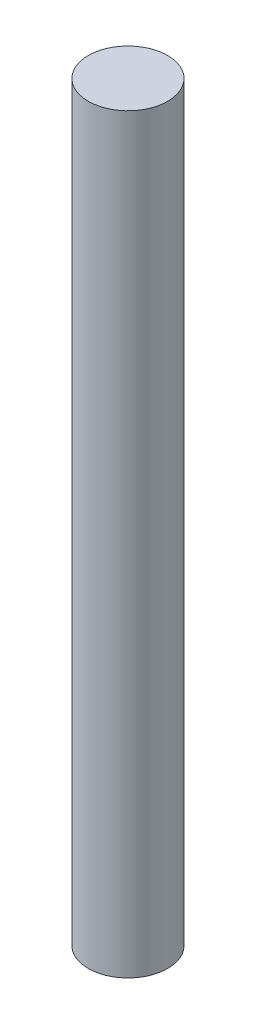
from build123d import *

# Parameters (mm, degrees)
SKETCH1_R           = 1.585
BOSS_EXTRUDE1_DEPTH = 30


with BuildPart() as part:
    # Sketch1 → Boss-Extrude1 (new body)
    with BuildSketch(Plane(origin=(0, 0, 0), x_dir=(1, 0, 0), z_dir=(0, 1, 0))):
        with Locations(Location((0, 0, 0), (0, 0, 270))):
            Circle(SKETCH1_R)
    extrude(amount=BOSS_EXTRUDE1_DEPTH)


solid = part.part
